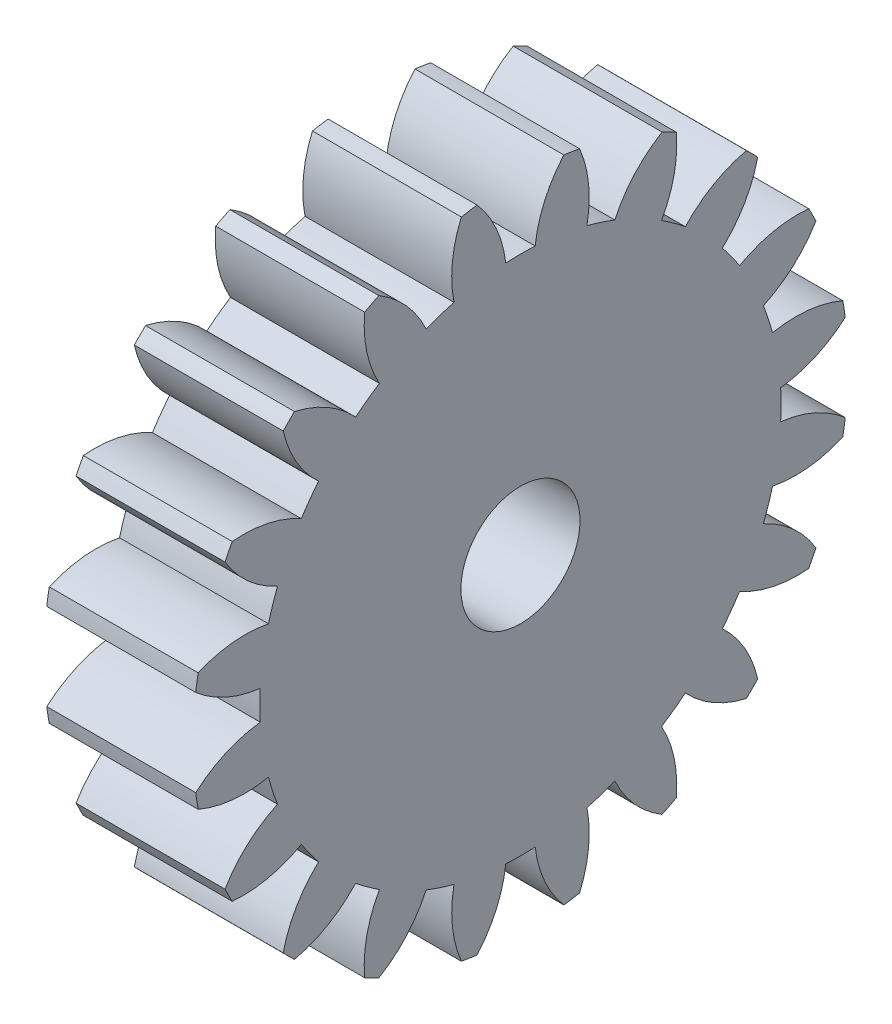
from build123d import *

# Parameters (mm, degrees)
BASPROSKE_W     = 10
BASPROSKE_H     = 22
TOOTHCUT_DEPTH  = 33.680269277
TEETHCUTS_COUNT = 20
TEETHCUTS_ANGLE = 342
BORSKE_R        = 4
BORE_DEPTH      = 50.0000508


with BuildPart() as part:
    # BasProSke → Base-Revolve (revolve)
    with BuildSketch(Plane(origin=(0, 0, 0), x_dir=(1, 0, 0), z_dir=(0, 1, 0)), mode=Mode.PRIVATE) as base_revolve_sk:
        with Locations((5, 11)):
            Rectangle(BASPROSKE_W, BASPROSKE_H)
    revolve(base_revolve_sk.sketch.rotate(Axis((-10, 0, 0), (1, 0, 0)), 180), axis=Axis((-10, 0, 0), (1, 0, 0)))

    # TooCutSke → ToothCut (cut, through all)
    with BuildSketch(Plane(origin=(0, 0, 0), x_dir=(0, 0, -1), z_dir=(1, 0, 0))):
        with BuildLine():
            ThreePointArc((0.986171591, 17.471189616), (0, 17.499), (-0.986171591, 17.471189616))
            ThreePointArc((-0.986171591, 17.471189616), (-1.626916196, 19.798789858), (-2.932850173, 21.829260982))
            ThreePointArc((-2.932850173, 21.829260982), (0, 22.0254), (2.932850173, 21.829260982))
            ThreePointArc((2.932850173, 21.829260982), (1.626916196, 19.798789858), (0.986171591, 17.471189616))
        make_face()
    toothcut = extrude(amount=TOOTHCUT_DEPTH, mode=Mode.SUBTRACT)

    # TeethCuts: ToothCut ×20 about axis
    teethcuts_axis = Axis((-10, 0, 0), (1, 0, 0))
    for i in range(1, TEETHCUTS_COUNT):
        add(toothcut.rotate(teethcuts_axis, i * TEETHCUTS_ANGLE / (TEETHCUTS_COUNT - 1)), mode=Mode.SUBTRACT)

    # BorSke → Bore (cut, symmetric)
    with BuildSketch(Plane(origin=(0, 0, 0), x_dir=(0, 0, -1), z_dir=(1, 0, 0))):
        with Locations(Location((0, 0, 0), (0, 0, 180))):
            Circle(BORSKE_R)
    extrude(amount=BORE_DEPTH, both=True, mode=Mode.SUBTRACT)


solid = part.part
